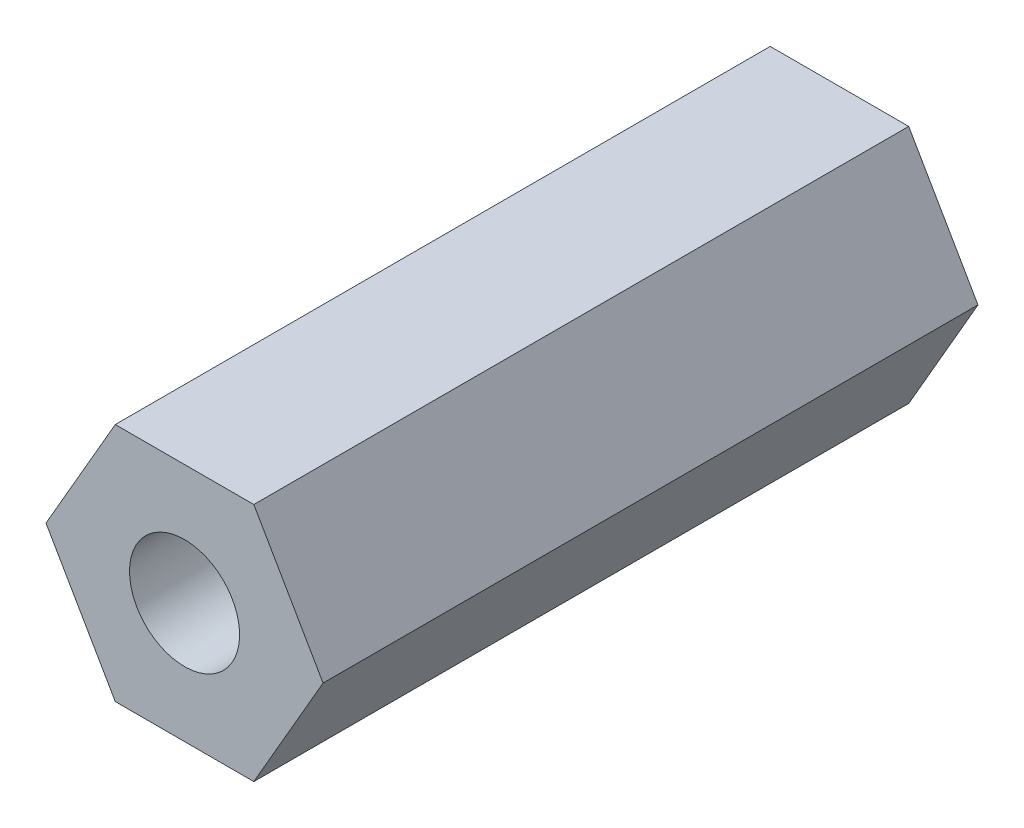
from build123d import *

# Parameters (mm, degrees)
BOSS_EXTRUDE1_DEPTH = 15.113
SKETCH2_R           = 1.27
CUT_EXTRUDE1_DEPTH  = 16.693569051


with BuildPart() as part:
    # Sketch1 → Boss-Extrude1 (new body)
    with BuildSketch(Plane.XY):
        Polygon((-3.196903911, 0), (-1.598451955, -2.7686), (1.598451955, -2.7686), (3.196903911, 0), (1.598451955, 2.7686), (-1.598451955, 2.7686), align=None)
    extrude(amount=BOSS_EXTRUDE1_DEPTH)

    # Sketch2 → Cut-Extrude1 (cut, through all)
    with BuildSketch(Plane(origin=(0, 0, 0), x_dir=(-1, 0, 0), z_dir=(0, 0, -1))):
        Circle(SKETCH2_R)
    extrude(amount=-CUT_EXTRUDE1_DEPTH, mode=Mode.SUBTRACT)


solid = part.part
